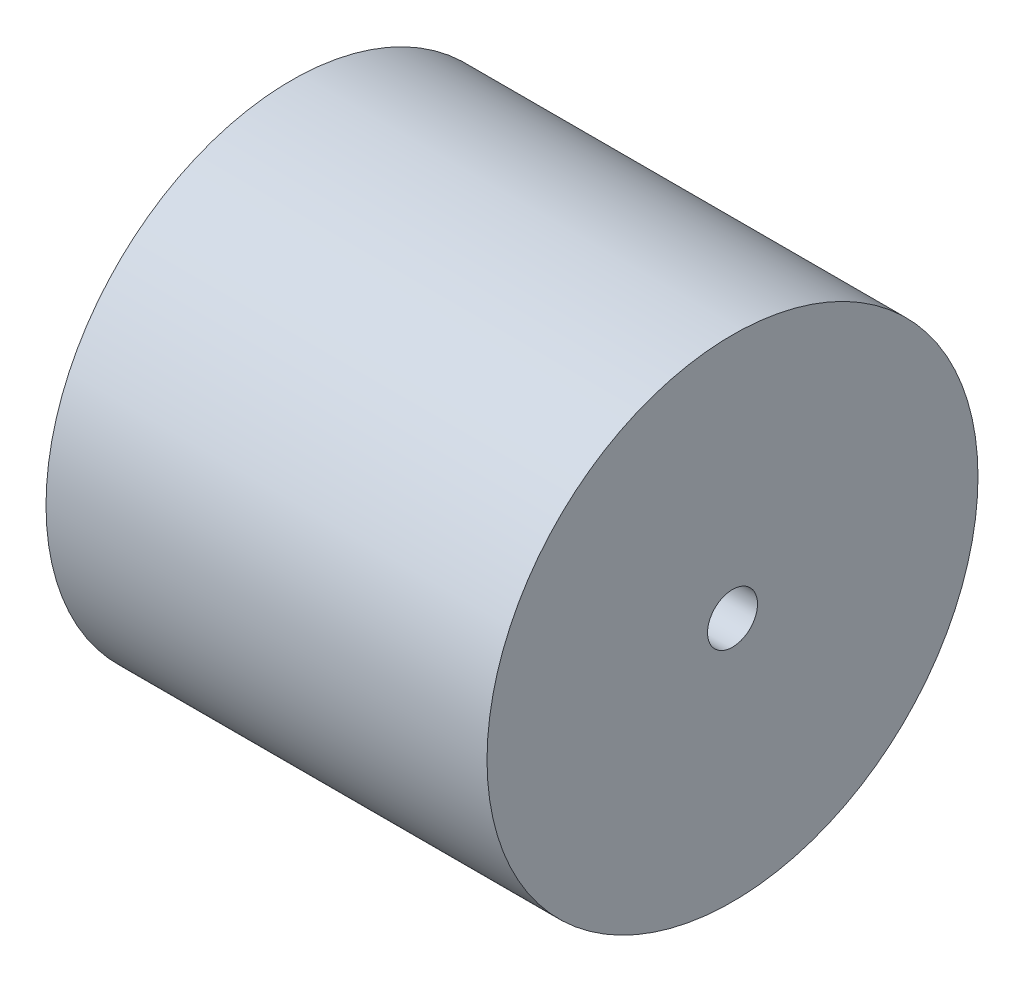
from build123d import *

# Parameters (mm, degrees)
SKETCH1_R           = 16.7
BOSS_EXTRUDE1_DEPTH = 30
CUT_EXTRUDE1_REACH  = 40.181
SKETCH2_R           = 1.7


with BuildPart() as part:
    # Sketch1 → Boss-Extrude1 (new body)
    with BuildSketch(Plane.YZ):
        with Locations(Location((0, 0, 0), (0, 0, 270))):
            Circle(SKETCH1_R)
    extrude(amount=BOSS_EXTRUDE1_DEPTH)

    # Sketch2 → Cut-Extrude1 (cut, up to next)
    with BuildSketch(Plane.YZ.offset(30), mode=Mode.PRIVATE) as cut_extrude1_sk1:
        with Locations(Location((0, 0, 0), (0, 0, 270))):
            Circle(SKETCH2_R)
    cut_extrude1_tool1 = extrude(cut_extrude1_sk1.sketch, amount=-CUT_EXTRUDE1_REACH, mode=Mode.PRIVATE) & part.part
    add(cut_extrude1_tool1.solids().sort_by_distance((30, 0, 0))[0], mode=Mode.SUBTRACT)


solid = part.part
